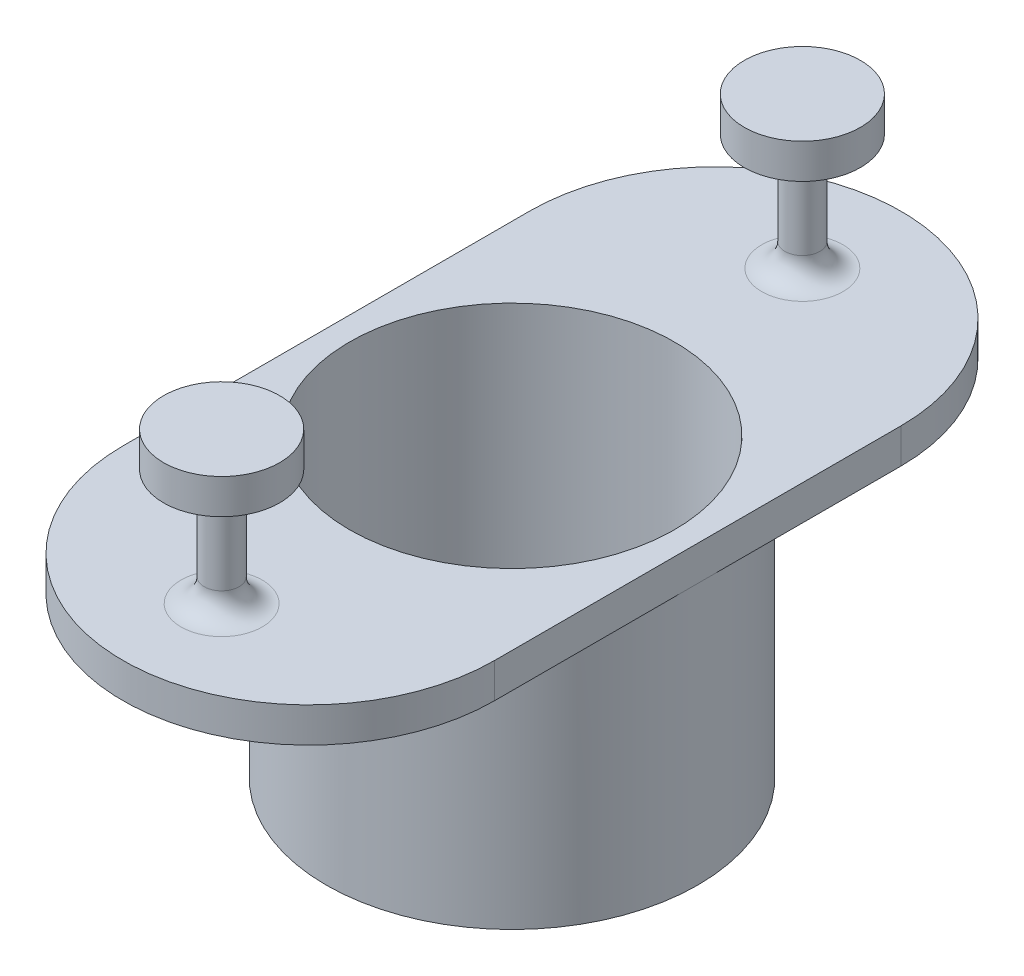
from build123d import *

# Parameters (mm, degrees)
SKETCH1_R           = 16
BOSS_EXTRUDE1_DEPTH = 22.5
BOSS_EXTRUDE2_DEPTH = 3
SKETCH3_R           = 1.5
BOSS_EXTRUDE3_DEPTH = 10
SKETCH4_R           = 14
CUT_EXTRUDE1_DEPTH  = 23.5
SKETCH5_R           = 1.5
CUT_EXTRUDE2_DEPTH  = 51.00499975
SKETCH7_R           = 5
BOSS_EXTRUDE4_DEPTH = 3
FILLET1_R           = 2


with BuildPart() as part:
    # Sketch1 → Boss-Extrude1 (new body)
    with BuildSketch(Plane(origin=(0, 0, 0), x_dir=(1, 0, 0), z_dir=(0, 1, 0))):
        with Locations(Location((0, 0, 0), (0, 0, 90))):
            Circle(SKETCH1_R)
    extrude(amount=BOSS_EXTRUDE1_DEPTH)

    # Sketch2 → Boss-Extrude2 (add)
    with BuildSketch(Plane(origin=(0, 22.5, 0), x_dir=(1, 0, 0), z_dir=(0, 1, 0))):
        with BuildLine():
            Line((-16, -17.5), (-16, 17.5))
            ThreePointArc((-16, 17.5), (0, 33.5), (16, 17.5))
            Line((16, 17.5), (16, -17.5))
            ThreePointArc((16, -17.5), (0, -33.5), (-16, -17.5))
        make_face()
    extrude(amount=BOSS_EXTRUDE2_DEPTH)

    # Sketch3 → Boss-Extrude3 (add)
    with BuildSketch(Plane(origin=(0, 25.5, 0), x_dir=(1, 0, 0), z_dir=(0, 1, 0))):
        with Locations(Location((0, 25, 0), (0, 0, 270))):
            Circle(SKETCH3_R)
        with Locations(Location((0, -25, 0), (0, 0, 270))):
            Circle(SKETCH3_R)
    extrude(amount=BOSS_EXTRUDE3_DEPTH)

    # Sketch4 → Cut-Extrude1 (cut)
    with BuildSketch(Plane(origin=(0, 25.5, 0), x_dir=(1, 0, 0), z_dir=(0, 1, 0))):
        with Locations(Location((0, 0, 0), (0, 0, 270))):
            Circle(SKETCH4_R)
    extrude(amount=-CUT_EXTRUDE1_DEPTH, mode=Mode.SUBTRACT)

    # Sketch5 → Cut-Extrude2 (cut, through all)
    with BuildSketch(Plane(origin=(0, 2, 0), x_dir=(1, 0, 0), z_dir=(0, 1, 0))):
        with Locations(Location((8, 0, 0), (0, 0, 270))):
            Circle(SKETCH5_R)
        with Locations(Location((-8, 0, 0), (0, 0, 270))):
            Circle(SKETCH5_R)
    extrude(amount=-CUT_EXTRUDE2_DEPTH, mode=Mode.SUBTRACT)

    # Sketch7 → Boss-Extrude4 (add)
    with BuildSketch(Plane(origin=(0, 35.5, 0), x_dir=(1, 0, 0), z_dir=(0, 1, 0))):
        with Locations(Location((0, 25, 0), (0, 0, 270))):
            Circle(SKETCH7_R)
        with Locations(Location((0, -25, 0), (0, 0, 270))):
            Circle(SKETCH7_R)
    extrude(amount=BOSS_EXTRUDE4_DEPTH)

    # Fillet1
    fillet1_edges = [part.edges().sort_by_distance(p)[0] for p in [
        (0, 25.5, -26.5),
        (0, 35.5, -26.5),
        (0, 25.5, 23.5),
        (0, 35.5, 23.5),
    ]]
    fillet(fillet1_edges, radius=FILLET1_R)


solid = part.part
